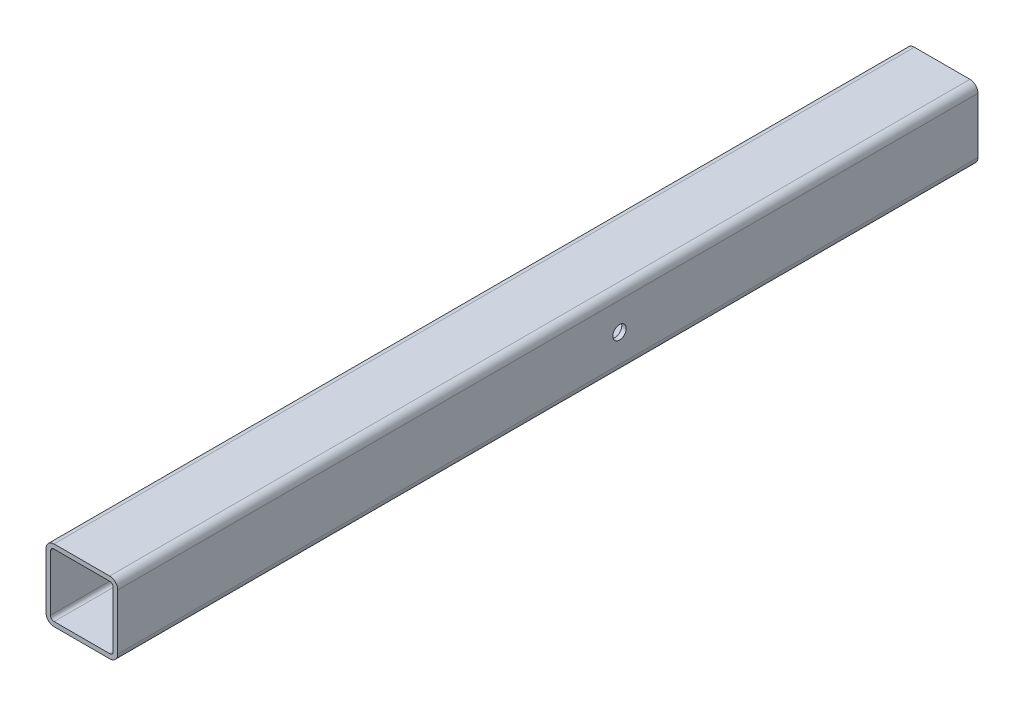
from build123d import *

# Parameters (mm, degrees)
BOSS_EXTRUDE1_DEPTH = 304.8
SKETCH3_R           = 4.7625
CUT_EXTRUDE2_DEPTH  = 76.2


with BuildPart() as part:
    # Sketch1 → Boss-Extrude1 (new, symmetric)
    with BuildSketch(Plane.XY):
        with BuildLine():
            Line((-19.685, 25.4), (19.685, 25.4))
            ThreePointArc((19.685, 25.4), (23.726115254, 23.726115254), (25.4, 19.685))
            Line((25.4, 19.685), (25.4, -19.685))
            ThreePointArc((25.4, -19.685), (23.726115254, -23.726115254), (19.685, -25.4))
            Line((19.685, -25.4), (-19.685, -25.4))
            ThreePointArc((-19.685, -25.4), (-23.726115254, -23.726115254), (-25.4, -19.685))
            Line((-25.4, -19.685), (-25.4, 19.685))
            ThreePointArc((-25.4, 19.685), (-23.726115254, 23.726115254), (-19.685, 25.4))
        make_face()
        with BuildLine():
            Line((-19.685, -22.225), (19.685, -22.225))
            ThreePointArc((19.685, -22.225), (21.481051224, -21.481051224), (22.225, -19.685))
            Line((22.225, -19.685), (22.225, 19.685))
            ThreePointArc((22.225, 19.685), (21.481051224, 21.481051224), (19.685, 22.225))
            Line((19.685, 22.225), (-19.685, 22.225))
            ThreePointArc((-19.685, 22.225), (-21.481051224, 21.481051224), (-22.225, 19.685))
            Line((-22.225, 19.685), (-22.225, -19.685))
            ThreePointArc((-22.225, -19.685), (-21.481051224, -21.481051224), (-19.685, -22.225))
        make_face(mode=Mode.SUBTRACT)
    extrude(amount=BOSS_EXTRUDE1_DEPTH, both=True)

    # Sketch3 → Cut-Extrude2 (cut)
    with BuildSketch(Plane(origin=(25.4, 0, 0), x_dir=(0, 0, -1), z_dir=(1, 0, 0))):
        with Locations(Location((50.8, 0, 0), (0, 0, 90))):
            Circle(SKETCH3_R)
    extrude(amount=-CUT_EXTRUDE2_DEPTH, mode=Mode.SUBTRACT)


solid = part.part
